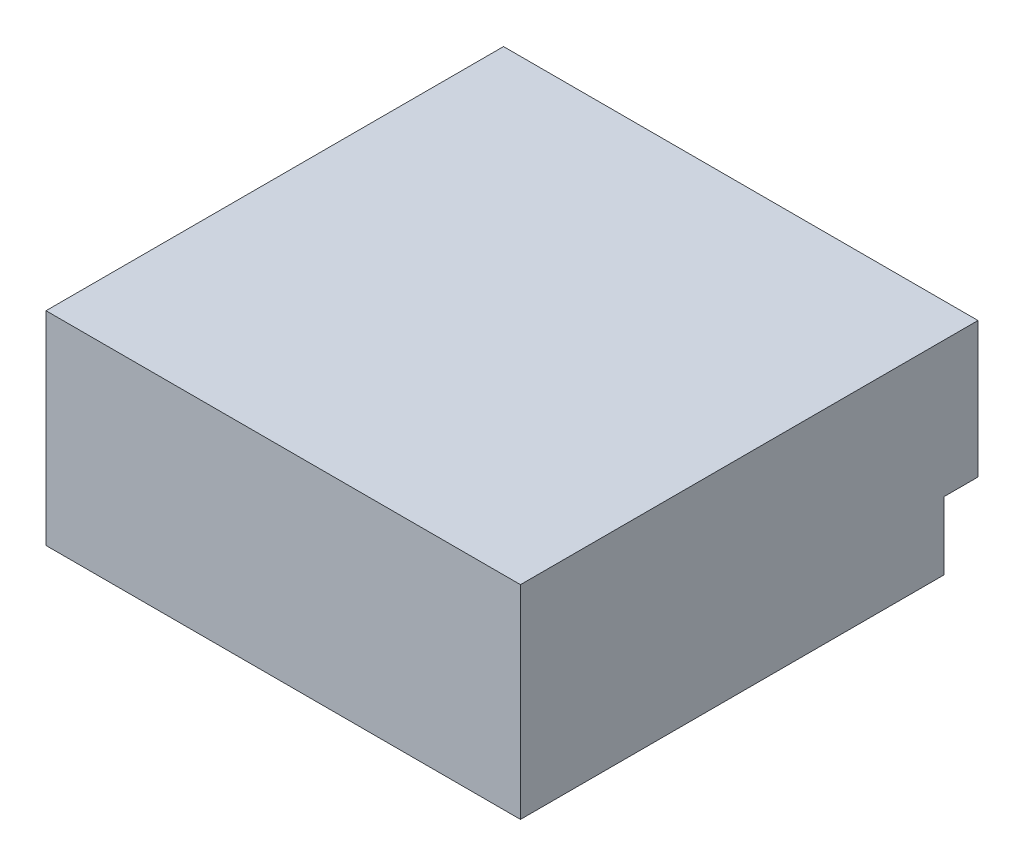
from build123d import *

# Parameters (mm, degrees)
SKETCH1_W           = 177.8
SKETCH1_H           = 76.2
BOSS_EXTRUDE1_DEPTH = 171.45
SKETCH2_W           = 50.8
SKETCH2_H           = 25.4
CUT_EXTRUDE1_DEPTH  = 12.7
SKETCH3_R           = 6.35
BOSS_EXTRUDE2_DEPTH = 6.35


with BuildPart() as part:
    # Sketch1 → Boss-Extrude1 (new body)
    with BuildSketch(Plane.XY):
        Rectangle(SKETCH1_W, SKETCH1_H)
    extrude(amount=BOSS_EXTRUDE1_DEPTH)

    # Sketch2 → Cut-Extrude1 (cut)
    with BuildSketch(Plane(origin=(0, 0, 0), x_dir=(-1, 0, 0), z_dir=(0, 0, -1))):
        with Locations((-63.5, -25.4)):
            Rectangle(SKETCH2_W, SKETCH2_H)
        with Locations((63.5, -25.4)):
            Rectangle(SKETCH2_W, SKETCH2_H)
    extrude(amount=-CUT_EXTRUDE1_DEPTH, mode=Mode.SUBTRACT)

    # Sketch3 → Boss-Extrude2 (add)
    with BuildSketch(Plane(origin=(0, 0, 12.7), x_dir=(-1, 0, 0), z_dir=(0, 0, -1))):
        with Locations(Location((-63.5, -25.4, 0), (0, 0, 180))):
            Circle(SKETCH3_R)
        with Locations(Location((63.5, -25.4, 0), (0, 0, 180))):
            Circle(SKETCH3_R)
    extrude(amount=BOSS_EXTRUDE2_DEPTH)


solid = part.part
